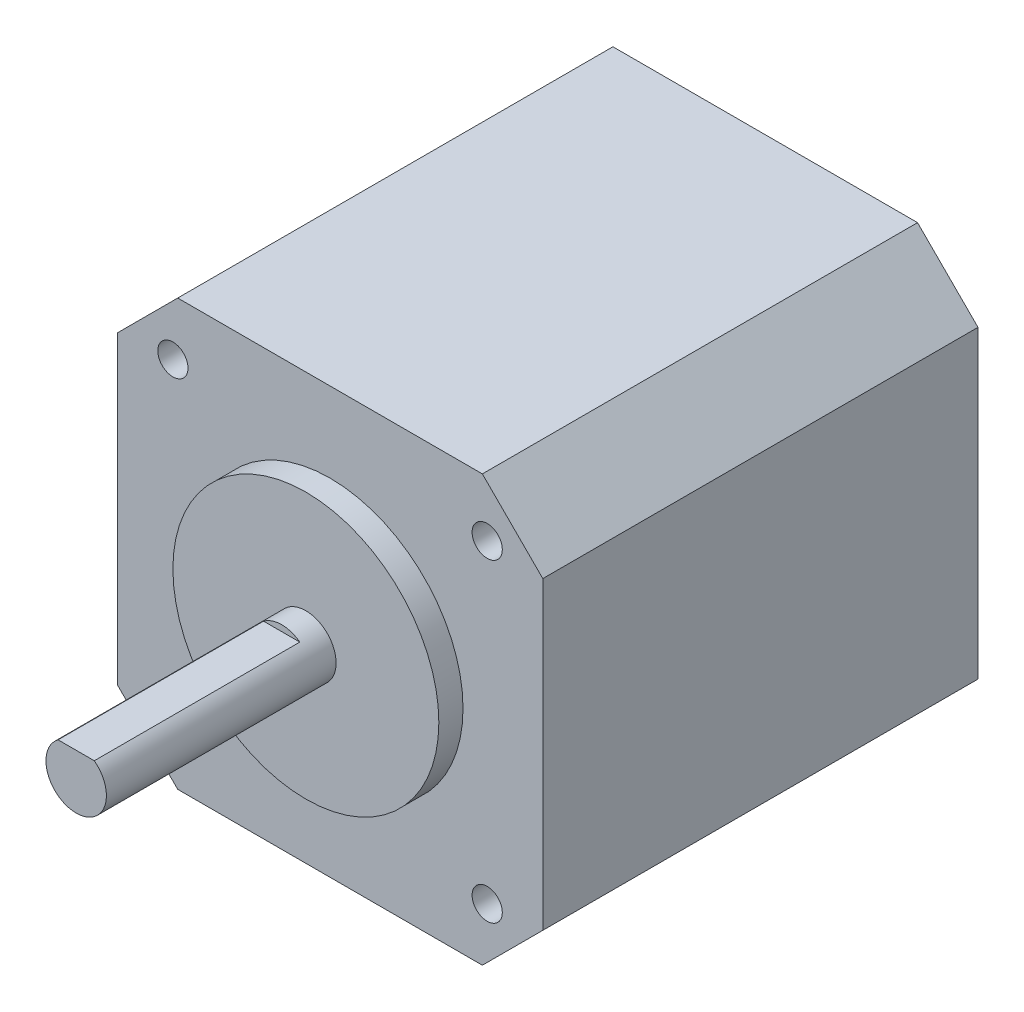
from build123d import *

# Parameters (mm, degrees)
SKETCH1_W           = 35.2
SKETCH1_H           = 35.2
BOSS_EXTRUDE1_DEPTH = 36
SKETCH2_R           = 11
BOSS_EXTRUDE2_DEPTH = 2
SKETCH3_R           = 2.5
BOSS_EXTRUDE3_DEPTH = 19
CHAMFER1_SIZE       = 5
CIRPATTERN1_COUNT   = 4
SKETCH6_W           = 4.502968974
SKETCH6_H           = 1.338593798
CUT_EXTRUDE1_DEPTH  = 17


with BuildPart() as part:
    # Sketch1 → Boss-Extrude1 (new body)
    with BuildSketch(Plane.XY):
        Rectangle(SKETCH1_W, SKETCH1_H)
    extrude(amount=BOSS_EXTRUDE1_DEPTH)

    # Sketch2 → Boss-Extrude2 (add)
    with BuildSketch(Plane.XY.offset(36)):
        with Locations(Location((0, 0, 0), (0, 0, 180))):
            Circle(SKETCH2_R)
    extrude(amount=BOSS_EXTRUDE2_DEPTH)

    # Sketch3 → Boss-Extrude3 (add)
    with BuildSketch(Plane.XY.offset(38)):
        Circle(SKETCH3_R)
    extrude(amount=BOSS_EXTRUDE3_DEPTH)

    # Chamfer1
    chamfer1_edges = [part.edges().sort_by_distance(p)[0] for p in [
        (-17.6, 17.6, 18),
        (17.6, 17.6, 18),
        (17.6, -17.6, 18),
        (-17.6, -17.6, 18),
    ]]
    chamfer(chamfer1_edges, length=CHAMFER1_SIZE)

    # Sketch4 → M3x0.5 Tapped Hole1 (revolve, cut)
    with BuildSketch(Plane(origin=(13, 13, 36), x_dir=(0, -1, 0), z_dir=(1, 0, 0))):
        Polygon((0, 0), (0, 6.251075774), (1.25, 5.5), (1.25, 0), align=None)
    m3x0_5_tapped_hole1 = revolve(axis=Axis((13, 13, 42.35), (0, 0, -1)), mode=Mode.SUBTRACT)

    # CirPattern1: M3x0.5 Tapped Hole1 ×4 about axis
    cirpattern1_axis = Axis((0, 0, 0), (0, 0, 1))
    for i in range(1, CIRPATTERN1_COUNT):
        add(m3x0_5_tapped_hole1.rotate(cirpattern1_axis, i * 360 / CIRPATTERN1_COUNT), mode=Mode.SUBTRACT)

    # Sketch6 → Cut-Extrude1 (cut)
    with BuildSketch(Plane.XY.offset(57)):
        with Locations((-0.129996357, 2.669296899)):
            Rectangle(SKETCH6_W, SKETCH6_H)
    extrude(amount=-CUT_EXTRUDE1_DEPTH, mode=Mode.SUBTRACT)

    # Mirror1: M3x0.5 Tapped Hole1 across plane
    add(m3x0_5_tapped_hole1.mirror(Plane(origin=(0, 0, 18), x_dir=(1, 0, 0), z_dir=(0, 0, -1))), mode=Mode.SUBTRACT)

    # Mirror1 copy 1 sketch → Mirror1 copy 1 (revolve, cut)
    with BuildSketch(Plane(origin=(-13, 13, 0), x_dir=(1, 0, 0), z_dir=(0, 1, 0))):
        Polygon((0, 0), (0, -6.251075774), (1.25, -5.5), (1.25, 0), align=None)
    revolve(axis=Axis((-13, 13, -6.35), (0, 0, -1)), mode=Mode.SUBTRACT)

    # Mirror1 copy 2 sketch → Mirror1 copy 2 (revolve, cut)
    with BuildSketch(Plane(origin=(-13, -13, 0), x_dir=(0, 1, 0), z_dir=(-1, 0, 0))):
        Polygon((0, 0), (0, -6.251075774), (1.25, -5.5), (1.25, 0), align=None)
    revolve(axis=Axis((-13, -13, -6.35), (0, 0, -1)), mode=Mode.SUBTRACT)

    # Mirror1 copy 3 sketch → Mirror1 copy 3 (revolve, cut)
    with BuildSketch(Plane(origin=(13, -13, 0), x_dir=(-1, 0, 0), z_dir=(0, -1, 0))):
        Polygon((0, 0), (0, -6.251075774), (1.25, -5.5), (1.25, 0), align=None)
    revolve(axis=Axis((13, -13, -6.35), (0, 0, -1)), mode=Mode.SUBTRACT)


solid = part.part
